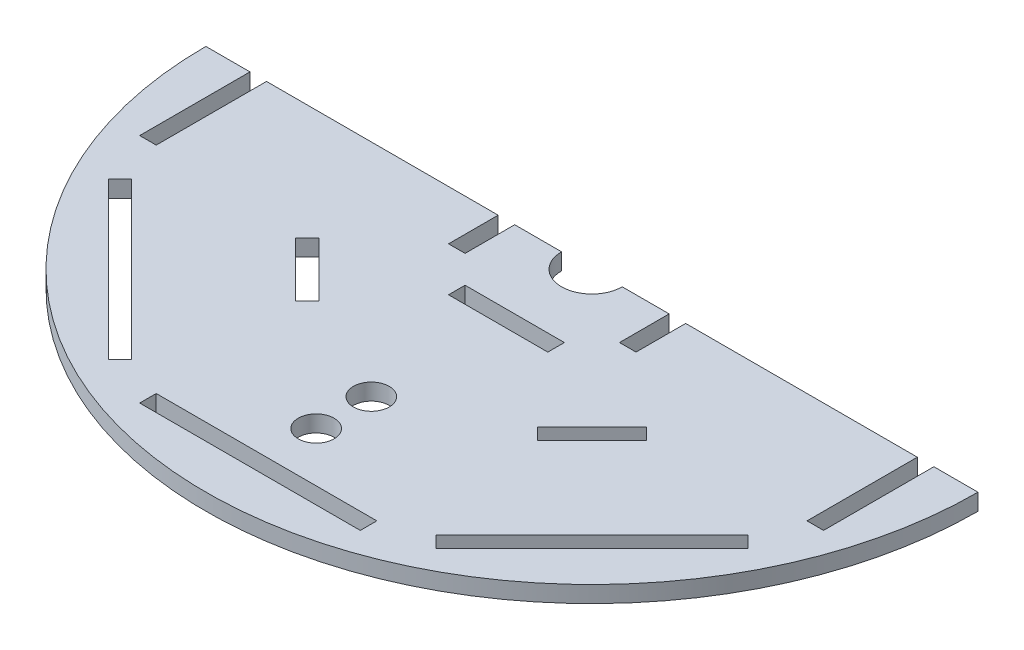
from build123d import *

# Parameters (mm, degrees)
CROQUIS1_R              = 3.25
SALIENTE_EXTRUIR1_DEPTH = 3


with BuildPart() as part:
    # Croquis1 → Saliente-Extruir1 (new body)
    with BuildSketch(Plane(origin=(0, 0, 0), x_dir=(1, 0, 0), z_dir=(0, 1, 0))):
        with BuildLine():
            Line((-59, 0), (-17, 0))
            Line((-17, 0), (-17, -9))
            Line((-17, -9), (-14, -9))
            Line((-14, -9), (-14, 0))
            Line((-14, 0), (-5.5, 0))
            ThreePointArc((-5.5, 0), (0, -5.5), (5.5, 0))
            Line((5.5, 0), (14, 0))
            Line((14, 0), (14, -9))
            Line((14, -9), (17, -9))
            Line((17, -9), (17, 0))
            Line((17, 0), (59, 0))
            Line((59, 0), (59, -20))
            Line((59, -20), (62, -20))
            Line((62, -20), (62, 0))
            Line((62, 0), (70, 0))
            ThreePointArc((70, 0), (0, -70), (-70, 0))
            Line((-70, 0), (-62, 0))
            Line((-62, 0), (-62, -20))
            Line((-62, -20), (-59, -20))
            Line((-59, -20), (-59, 0))
        make_face()
        with Locations(Location((0, -50, 0), (0, 0, 270))):
            Circle(CROQUIS1_R, mode=Mode.SUBTRACT)
        with Locations(Location((0, -40, 0), (0, 0, 270))):
            Circle(CROQUIS1_R, mode=Mode.SUBTRACT)
        Polygon((24.748737342, -24.748737342), (19.798989873, -29.69848481), (21.920310217, -31.819805153), (31.819805153, -21.920310217), (29.69848481, -19.798989873), align=None, mode=Mode.SUBTRACT)
        Polygon((-24.748737342, -24.748737342), (-29.69848481, -19.798989873), (-31.819805153, -21.920310217), (-21.920310217, -31.819805153), (-19.798989873, -29.69848481), align=None, mode=Mode.SUBTRACT)
        Polygon((-9, -14), (-9, -17), (9, -17), (9, -14), (0, -14), align=None, mode=Mode.SUBTRACT)
        Polygon((27.577164466, -55.861435714), (55.861435714, -27.577164466), (57.982756057, -29.69848481), (43.840620434, -43.840620434), (29.69848481, -57.982756057), align=None, mode=Mode.SUBTRACT)
        Polygon((-20, -59), (20, -59), (20, -62), (0, -62), (-20, -62), align=None, mode=Mode.SUBTRACT)
        Polygon((-55.861435714, -27.577164466), (-27.577164466, -55.861435714), (-29.69848481, -57.982756057), (-43.840620434, -43.840620434), (-57.982756057, -29.69848481), align=None, mode=Mode.SUBTRACT)
    extrude(amount=SALIENTE_EXTRUIR1_DEPTH)


solid = part.part
